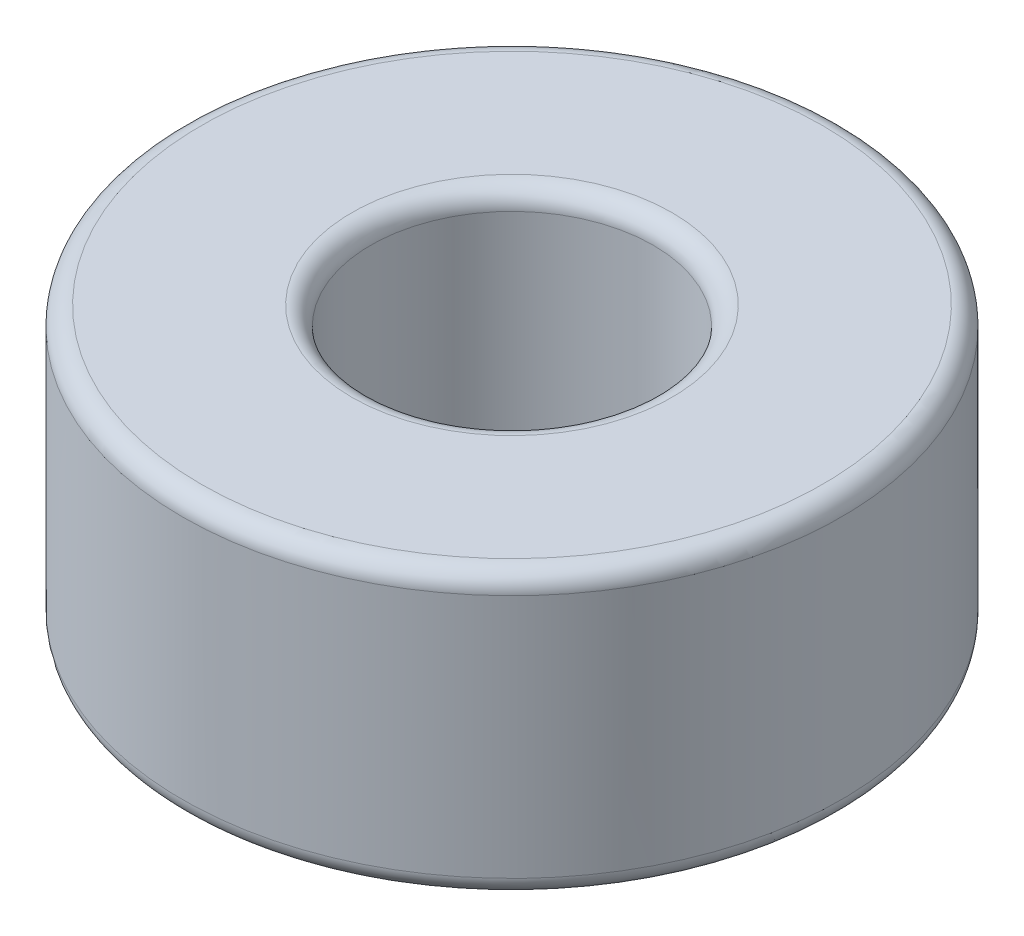
from build123d import *

# Parameters (mm, degrees)
ESQUISSE1_W = 2
ESQUISSE1_H = 3
CONG_1_R    = 0.2


with BuildPart() as part:
    # Esquisse1 → Révolution1 (revolve)
    with BuildSketch(Plane.XY, mode=Mode.PRIVATE) as r_volution1_sk:
        with Locations((2.5, 1.5)):
            Rectangle(ESQUISSE1_W, ESQUISSE1_H)
    revolve(r_volution1_sk.sketch.rotate(Axis((0, 0, 0), (0, 1, 0)), 90), axis=Axis((0, 0, 0), (0, 1, 0)))

    # Congé1
    cong_1_edges = [part.edges().sort_by_distance(p)[0] for p in [
        (0, 0, 1.5),
        (0, 0, 3.5),
        (0, 3, 3.5),
        (0, 3, 1.5),
    ]]
    fillet(cong_1_edges, radius=CONG_1_R)


solid = part.part
